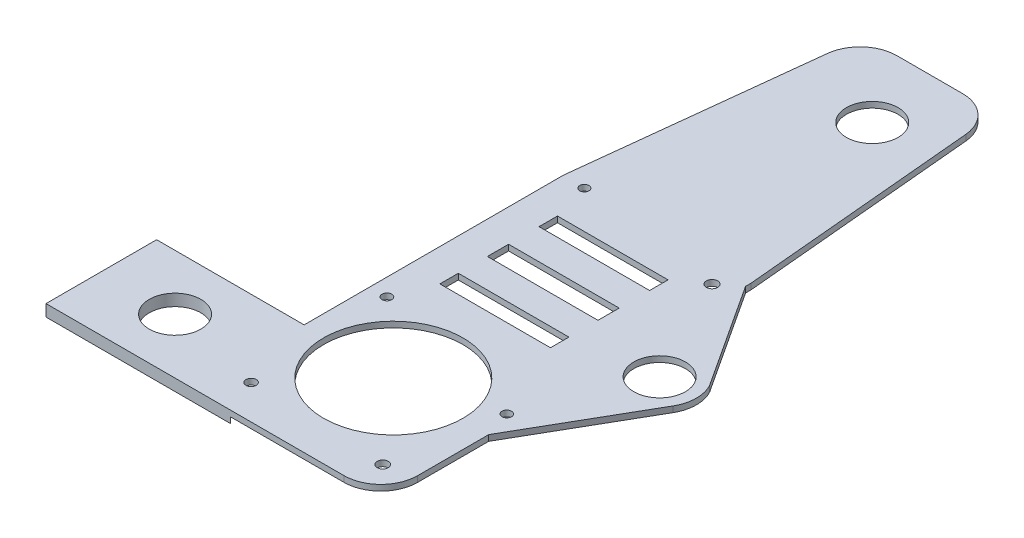
from build123d import *

# Parameters (mm, degrees)
SKETCH1_R           = 2.875
SKETCH1_R_2         = 7
BOSS_EXTRUDE1_DEPTH = 24.5875
SKETCH4_W           = 66.272407177
SKETCH4_H           = 27.800260981
CUT_EXTRUDE2_DEPTH  = 20
FILLET3_R           = 10
FILLET4_R           = 10
BOSS_EXTRUDE3_START = -1.5875
BOSS_EXTRUDE3_DEPTH = 1.5875
SKETCH7_R           = 7
CUT_EXTRUDE3_DEPTH  = 1.5875
CUT_EXTRUDE4_START  = -10
SKETCH8_R           = 3
SKETCH8_R_2         = 18.9
SKETCH8_R_3         = 2.875
SKETCH8_R_4         = 7
CUT_EXTRUDE4_DEPTH  = 10
SKETCH9_W           = 229.1070397
SKETCH9_H           = 361.266964835
SKETCH9_R           = 1.388229101
SKETCH9_R_2         = 1.483383261
SKETCH9_R_3         = 1.314910669
SKETCH9_R_4         = 1.248623853
SKETCH9_R_5         = 1.255629307
SKETCH9_R_6         = 1.53911217
CUT_EXTRUDE5_DEPTH  = 13
SKETCH10_W          = 29.988446547
SKETCH10_H          = 5
SKETCH10_H_2        = 5.75
CUT_EXTRUDE6_DEPTH  = 22
SKETCH11_R          = 5.236653548
CUT_EXTRUDE7_DEPTH  = 10
BOSS_EXTRUDE4_START = -1.59
BOSS_EXTRUDE4_DEPTH = 1.59
SKETCH13_R          = 7
CUT_EXTRUDE8_DEPTH  = 41
SKETCH14_W          = 61.491848917
SKETCH14_H          = 35.587491391
CUT_EXTRUDE9_DEPTH  = 20
FILLET5_R           = 10
SKETCH16_W          = 163.723031551
SKETCH16_H          = 22.872070304
CUT_EXTRUDE11_DEPTH = 35
FILLET6_R           = 10
SKETCH17_R          = 1.53911217
SKETCH17_R_2        = 1.255629307
SKETCH17_R_3        = 1.3
SKETCH17_R_4        = 1.314910669
SKETCH17_R_5        = 1.388229101
SKETCH17_R_6        = 1.5
CUT_EXTRUDE12_DEPTH = 42
CUT_EXTRUDE13_START = -30
SKETCH18_R          = 18.9
CUT_EXTRUDE13_DEPTH = 30
SKETCH19_R          = 7
BOSS_EXTRUDE5_DEPTH = 3.175


with BuildPart() as part:
    # Sketch1 → Boss-Extrude1 (new body)
    with BuildSketch(Plane(origin=(0, 0, 0), x_dir=(1, 0, 0), z_dir=(0, 1, 0))):
        with BuildLine():
            Line((42.32729629, 228.6), (10.454309325, 228.6))
            Line((10.454309325, 228.6), (0, 135.362739137))
            Line((0, 135.362739137), (0, 0))
            Line((0, 0), (24.327009544, 0))
            Line((24.327009544, 0), (50.8, 0))
            Line((50.8, 0), (50.8, 64.87909603))
            Line((50.8, 64.87909603), (50.8, 87.423477361))
            Line((50.8, 87.423477361), (50.8, 98.200996728))
            ThreePointArc((50.8, 98.200996728), (50.4, 101.000996728), (50.8, 103.800996728))
            Line((50.8, 103.800996728), (50.8, 104.488200565))
            Line((50.8, 104.488200565), (50.8, 120.619222808))
            Line((50.8, 120.619222808), (50.8, 135.362739137))
            Line((50.8, 135.362739137), (42.32729629, 228.6))
        make_face()
        with Locations(Location((24.101759227, 108.78493524, 0), (0, 0, 270))):
            Circle(SKETCH1_R, mode=Mode.SUBTRACT)
        with Locations(Location((29.504213454, 189.557234372, 0), (0, 0, 270))):
            Circle(SKETCH1_R_2, mode=Mode.SUBTRACT)
    extrude(amount=BOSS_EXTRUDE1_DEPTH)

    # Sketch4 → Cut-Extrude2 (cut)
    with BuildSketch(Plane(origin=(0, 0, -228.6), x_dir=(-1, 0, 0), z_dir=(0, 0, -1))):
        with Locations((-28.174690156, -1.980940155)):
            Rectangle(SKETCH4_W, SKETCH4_H)
    extrude(amount=-CUT_EXTRUDE2_DEPTH, mode=Mode.SUBTRACT)

    # Fillet3
    fillet3_edges = [part.edges().sort_by_distance(p)[0] for p in [
        (44.144746445, 5.959595168, -208.6),
    ]]
    fillet(fillet3_edges, radius=FILLET3_R)

    # Fillet4
    fillet4_edges = [part.edges().sort_by_distance(p)[0] for p in [
        (50.8, 12.29375, 0),
        (0, 12.29375, 0),
        (8.211791854, 5.959595168, -208.6),
    ]]
    fillet(fillet4_edges, radius=FILLET4_R)

    # Sketch6 → Boss-Extrude3 (add)
    with BuildSketch(Plane(origin=(0, 24.5875, 0), x_dir=(1, 0, 0), z_dir=(0, 1, 0)).offset(BOSS_EXTRUDE3_START)):
        with BuildLine():
            Line((50.8, 135.362739137), (50.8, 103.800996728))
            ThreePointArc((50.8, 103.800996728), (50.4, 101.000996728), (50.8, 98.200996728))
            Line((50.8, 98.200996728), (50.8, 61.124243317))
            Line((50.8, 61.124243317), (69.258211507, 96.360728536))
            ThreePointArc((69.258211507, 96.360728536), (70.393157133, 101.370875786), (68.890940865, 106.283413148))
            Line((68.890940865, 106.283413148), (50.8, 135.362739137))
        make_face()
    extrude(amount=BOSS_EXTRUDE3_DEPTH)

    # Sketch7 → Cut-Extrude3 (cut)
    with BuildSketch(Plane(origin=(0, 24.5875, 0), x_dir=(1, 0, 0), z_dir=(0, 1, 0))):
        with Locations(Location((60.4, 101.000996728, 0), (0, 0, 270))):
            Circle(SKETCH7_R)
    extrude(amount=-CUT_EXTRUDE3_DEPTH, mode=Mode.SUBTRACT)

    # Sketch8 → Cut-Extrude4 (cut)
    with BuildSketch(Plane(origin=(0, 24.5875, 0), x_dir=(1, 0, 0), z_dir=(0, 1, 0)).offset(CUT_EXTRUDE4_START)):
        with BuildLine():
            Line((10.454309325, 228.6), (0, 135.362739137))
            Line((0, 135.362739137), (0, 10))
            ThreePointArc((0, 10), (2.928932188, 2.928932188), (10, 0))
            Line((10, 0), (40.8, 0))
            ThreePointArc((40.8, 0), (47.871067812, 2.928932188), (50.8, 10))
            Line((50.8, 10), (50.8, 61.124243317))
            Line((50.8, 61.124243317), (69.258211507, 96.360728536))
            ThreePointArc((69.258211507, 96.360728536), (70.393157133, 101.370875786), (68.890940865, 106.283413148))
            Line((68.890940865, 106.283413148), (50.8, 135.362739137))
            Line((50.8, 135.362739137), (42.32729629, 228.6))
            Line((42.32729629, 228.6), (10.454309325, 228.6))
        make_face()
        with Locations(Location((9.492033273, 118.909935242, 0), (0, 0, 270))):
            Circle(SKETCH8_R, mode=Mode.SUBTRACT)
        with Locations(Location((24.583834565, 64.593886665, 0), (0, 0, 270))):
            Circle(SKETCH8_R_2, mode=Mode.SUBTRACT)
        with Locations(Location((24.101759227, 108.78493524, 0), (0, 0, 270))):
            Circle(SKETCH8_R_3, mode=Mode.SUBTRACT)
        with Locations((60.4, 101.000996728)):
            Circle(SKETCH8_R_4, mode=Mode.SUBTRACT)
        with Locations(Location((29.504213454, 189.557234372, 0), (0, 0, 270))):
            Circle(SKETCH8_R_4, mode=Mode.SUBTRACT)
    extrude(amount=CUT_EXTRUDE4_DEPTH, mode=Mode.SUBTRACT)

    # Sketch9 → Cut-Extrude5 (cut)
    with BuildSketch(Plane.XZ):
        with Locations((19.903204009, -125.752229467)):
            Rectangle(SKETCH9_W, SKETCH9_H)
        with Locations(Location((6.335590122, -44.288799513, 0), (0, 0, 270))):
            Circle(SKETCH9_R, mode=Mode.SUBTRACT)
        with Locations(Location((43.447673368, -42.868436544, 0), (0, 0, 270))):
            Circle(SKETCH9_R_2, mode=Mode.SUBTRACT)
        with Locations(Location((4.659546827, -82.793173401, 0), (0, 0, 270))):
            Circle(SKETCH9_R_3, mode=Mode.SUBTRACT)
        with Locations(Location((48.400988852, -71.551011715, 0), (0, 0, 270))):
            Circle(SKETCH9_R_4, mode=Mode.SUBTRACT)
        with Locations(Location((5.88467603, -135.103145298, 0), (0, 0, 270))):
            Circle(SKETCH9_R_5, mode=Mode.SUBTRACT)
        with Locations(Location((45.747747887, -129.863467374, 0), (0, 0, 270))):
            Circle(SKETCH9_R_6, mode=Mode.SUBTRACT)
    extrude(amount=-CUT_EXTRUDE5_DEPTH, mode=Mode.SUBTRACT)

    # Sketch10 → Cut-Extrude6 (cut)
    with BuildSketch(Plane(origin=(0, 24.5875, 0), x_dir=(1, 0, 0), z_dir=(0, 1, 0))):
        with Locations((23.779803557, 122.41493524)):
            Rectangle(SKETCH10_W, SKETCH10_H)
        with Locations((23.779803557, 108.78493524)):
            Rectangle(SKETCH10_W, SKETCH10_H_2)
        with Locations((23.779803557, 95.528937895)):
            Rectangle(SKETCH10_W, SKETCH10_H)
    extrude(amount=-CUT_EXTRUDE6_DEPTH, mode=Mode.SUBTRACT)

    # Sketch11 → Cut-Extrude7 (cut)
    with BuildSketch(Plane(origin=(0, 24.5875, 0), x_dir=(1, 0, 0), z_dir=(0, 1, 0))):
        with Locations((8.535526315, 118.29502971)):
            Circle(SKETCH11_R)
    extrude(amount=-CUT_EXTRUDE7_DEPTH, mode=Mode.SUBTRACT)

    # Sketch12 → Boss-Extrude4 (add)
    with BuildSketch(Plane(origin=(0, 14.5875, 0), x_dir=(1, 0, 0), z_dir=(0, 1, 0)).offset(BOSS_EXTRUDE4_START)):
        with BuildLine():
            Line((68.287536191, 107.148091395), (50.8, 133.900488173))
            Line((50.8, 133.900488173), (50.8, 103.800996728))
            ThreePointArc((50.8, 103.800996728), (58.520134646, 110.822712782), (68.287536191, 107.148091395))
        make_face()
        with BuildLine():
            Line((69.19540964, 105.759228466), (68.287536191, 107.148091395))
            ThreePointArc((68.287536191, 107.148091395), (58.520134646, 110.822712782), (50.8, 103.800996728))
            ThreePointArc((50.8, 103.800996728), (50.4, 101.000996728), (50.8, 98.200996728))
            ThreePointArc((50.8, 98.200996728), (59.211240578, 91.07190558), (69.067690563, 96.013899345))
            ThreePointArc((69.067690563, 96.013899345), (70.061182785, 98.419999404), (70.4, 101.000996728))
            ThreePointArc((70.4, 101.000996728), (70.094175994, 103.455167016), (69.19540964, 105.759228466))
        make_face()
        with BuildLine():
            ThreePointArc((69.067690563, 96.013899345), (59.211240578, 91.07190558), (50.8, 98.200996728))
            Line((50.8, 98.200996728), (50.8, 64.264230765))
            Line((50.8, 64.264230765), (69.067690563, 96.013899345))
        make_face()
    extrude(amount=BOSS_EXTRUDE4_DEPTH)

    # Sketch13 → Cut-Extrude8 (cut)
    with BuildSketch(Plane(origin=(0, 14.5875, 0), x_dir=(1, 0, 0), z_dir=(0, 1, 0))):
        with Locations(Location((60.4, 101.000996728, 0), (0, 0, 270))):
            Circle(SKETCH13_R)
    extrude(amount=-CUT_EXTRUDE8_DEPTH, mode=Mode.SUBTRACT)

    # Sketch14 → Cut-Extrude9 (cut)
    with BuildSketch(Plane(origin=(0, 0, -228.6), x_dir=(-1, 0, 0), z_dir=(0, 0, -1))):
        with Locations((-33.296946078, 21.381494753)):
            Rectangle(SKETCH14_W, SKETCH14_H)
    extrude(amount=-CUT_EXTRUDE9_DEPTH, mode=Mode.SUBTRACT)

    # Fillet5
    fillet5_edges = [part.edges().sort_by_distance(p)[0] for p in [
        (44.144746445, 13.79375, -208.6),
        (8.211791854, 13.79375, -208.6),
    ]]
    fillet(fillet5_edges, radius=FILLET5_R)

    # Sketch16 → Cut-Extrude11 (cut)
    with BuildSketch(Plane.XY):
        with Locations((6.935844153, 9.456999915)):
            Rectangle(SKETCH16_W, SKETCH16_H)
    extrude(amount=-CUT_EXTRUDE11_DEPTH, mode=Mode.SUBTRACT)

    # Fillet6
    fillet6_edges = [part.edges().sort_by_distance(p)[0] for p in [
        (0, 13.79375, -35),
        (50.8, 13.79375, -35),
    ]]
    fillet(fillet6_edges, radius=FILLET6_R)

    # Sketch17 → Cut-Extrude12 (cut)
    with BuildSketch(Plane.XZ):
        with Locations(Location((45.747747887, -129.863467374, 0), (0, 0, 270))):
            Circle(SKETCH17_R)
        with Locations(Location((5.88467603, -135.103145298, 0), (0, 0, 270))):
            Circle(SKETCH17_R_2)
        with Locations(Location((48.400988852, -71.551011715, 0), (0, 0, 270))):
            Circle(SKETCH17_R_3)
        with Locations(Location((4.659546827, -82.793173401, 0), (0, 0, 270))):
            Circle(SKETCH17_R_4)
        with Locations(Location((6.335590122, -44.288799513, 0), (0, 0, 270))):
            Circle(SKETCH17_R_5)
        with Locations(Location((43.447673368, -42.868436544, 0), (0, 0, 270))):
            Circle(SKETCH17_R_6)
    extrude(amount=-CUT_EXTRUDE12_DEPTH, mode=Mode.SUBTRACT)

    # Sketch18 → Cut-Extrude13 (cut)
    with BuildSketch(Plane(origin=(0, 24.5875, 0), x_dir=(1, 0, 0), z_dir=(0, 1, 0)).offset(CUT_EXTRUDE13_START)):
        with Locations(Location((24.583834565, 64.593886665, 0), (0, 0, 270))):
            Circle(SKETCH18_R)
    extrude(amount=CUT_EXTRUDE13_DEPTH, mode=Mode.SUBTRACT)

    # Sketch19 → Boss-Extrude5 (add)
    # profile 1 of 2: a face of its own
    with BuildSketch(Plane(origin=(0, 14.5875, 0), x_dir=(1, 0, 0), z_dir=(0, 1, 0))):
        Polygon((0, 45), (0, 65), (-40, 65), (-40, 35), (0, 35), align=None)
        with Locations(Location((-20, 50, 0), (0, 0, 270))):
            Circle(SKETCH19_R, mode=Mode.SUBTRACT)
    # profile 2 of 2: a face of its own
    with BuildSketch(Plane(origin=(0, 14.5875, 0), x_dir=(1, 0, 0), z_dir=(0, 1, 0))):
        with BuildLine():
            ThreePointArc((10, 35), (2.928932188, 37.928932188), (0, 45))
            Line((0, 45), (0, 35))
            Line((0, 35), (10, 35))
        make_face()
    extrude(amount=-BOSS_EXTRUDE5_DEPTH)


solid = part.part
